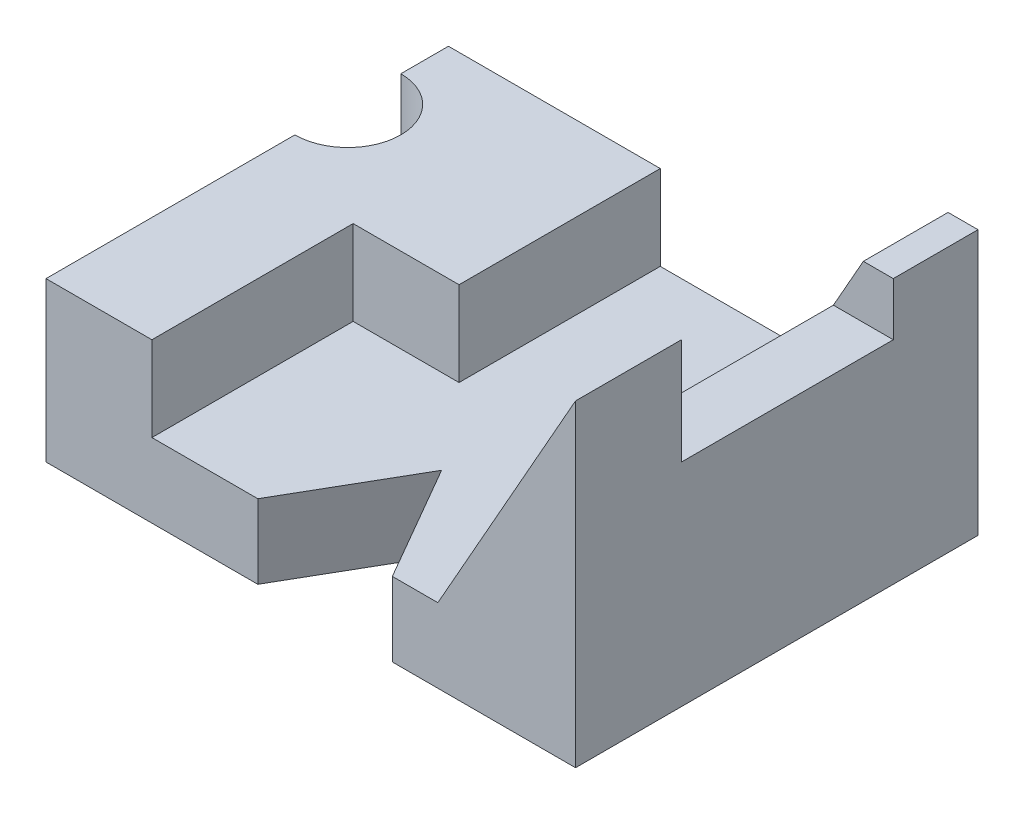
from build123d import *

# Parameters (mm, degrees)
EXTRUDE_1_DEPTH     = 38
SKETCH_2_R          = 5
SKETCH_2_W          = 10
SKETCH_2_H          = 19
CUT_EXTRUDE_1_DEPTH = 8
SKETCH_3_W          = 4
SKETCH_3_H          = 4
CUT_EXTRUDE_2_DEPTH = 51.970579749
CUT_EXTRUDE_3_DEPTH = 65.567793829


with BuildPart() as part:
    # Эскиз1 → Бобышка-Вытянуть1 (new body)
    with BuildSketch(Plane.XY):
        Polygon((-5, 0), (-25, 0), (-25, -15), (25, -15), (25, 15), (12, -8), (-5, -8), align=None)
    extrude(amount=EXTRUDE_1_DEPTH)

    # Эскиз2 → Вырез-Вытянуть1 (cut)
    with BuildSketch(Plane(origin=(0, 0, 0), x_dir=(1, 0, 0), z_dir=(0, 1, 0))):
        with Locations((-25, -9.5)):
            Circle(SKETCH_2_R)
        with Locations((-10, -28.5)):
            Rectangle(SKETCH_2_W, SKETCH_2_H)
    extrude(amount=-CUT_EXTRUDE_1_DEPTH, mode=Mode.SUBTRACT)

    # Эскиз3 → Вырез-Вытянуть2 (cut, through all)
    with BuildSketch(Plane(origin=(0, -8, 0), x_dir=(1, 0, 0), z_dir=(0, 1, 0))):
        with Locations((-25, -9.5)):
            Rectangle(SKETCH_3_W, SKETCH_3_H)
        Polygon((1.350852961, -27), (7.701705922, -38), (-5, -38), align=None)
    extrude(amount=-CUT_EXTRUDE_2_DEPTH, mode=Mode.SUBTRACT)

    # Эскиз4 → Вырез-Вытянуть3 (cut, through all)
    with BuildSketch(Plane(origin=(25, 0, 0), x_dir=(0, 0, -1), z_dir=(1, 0, 0))):
        Polygon((-8, 15), (-28, 15), (-28, 5), (-8, 5), (-8, 10), (0, 10), (0, 15), align=None)
    extrude(amount=-CUT_EXTRUDE_3_DEPTH, mode=Mode.SUBTRACT)


solid = part.part
